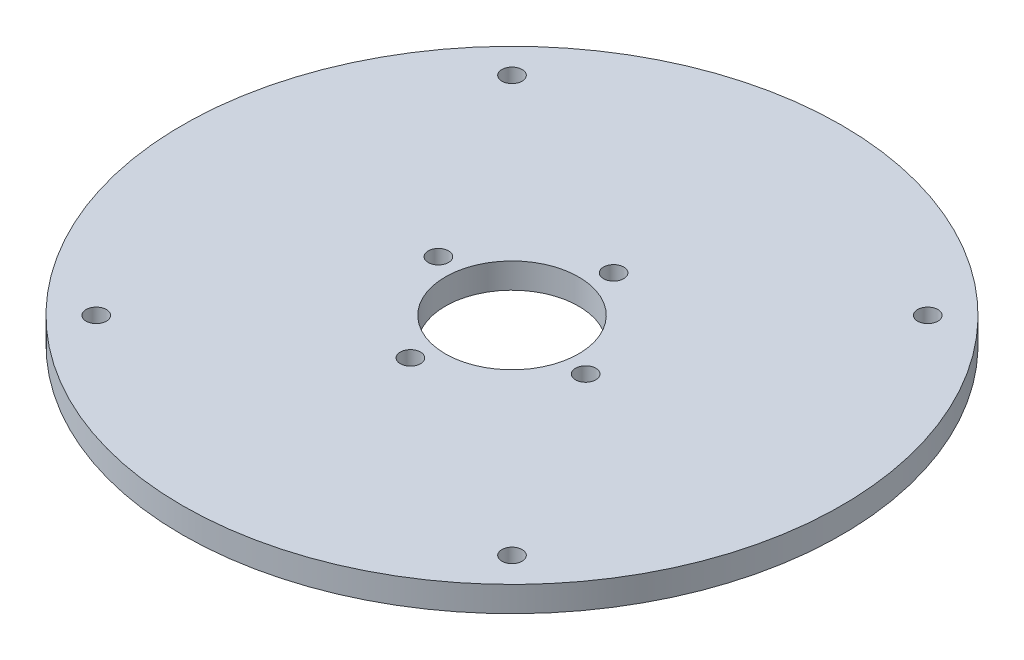
from build123d import *

# Parameters (mm, degrees)
SKETCH1_R           = 65
BOSS_EXTRUDE1_DEPTH = 5
SKETCH2_R           = 13.15
SKETCH2_R_2         = 2
CUT_EXTRUDE1_DEPTH  = 93.059763198
SKETCH4_R           = 2
CUT_EXTRUDE2_DEPTH  = 93.059763198


with BuildPart() as part:
    # Sketch1 → Boss-Extrude1 (new body)
    with BuildSketch(Plane(origin=(0, 0, 0), x_dir=(1, 0, 0), z_dir=(0, 1, 0))):
        with Locations(Location((0, 0, 0), (0, 0, 270))):
            Circle(SKETCH1_R)
    extrude(amount=BOSS_EXTRUDE1_DEPTH)

    # Sketch2 → Cut-Extrude1 (cut, through all)
    with BuildSketch(Plane(origin=(0, 5, 0), x_dir=(1, 0, 0), z_dir=(0, 1, 0))):
        with Locations(Location((0, 0, 0), (0, 0, 270))):
            Circle(SKETCH2_R)
        with Locations(Location((-17.281297977, 2.75803195, 0), (0, 0, 270))):
            Circle(SKETCH2_R_2)
        with Locations(Location((2.75803195, 17.281297977, 0), (0, 0, 270))):
            Circle(SKETCH2_R_2)
        with Locations(Location((17.281297977, -2.75803195, 0), (0, 0, 270))):
            Circle(SKETCH2_R_2)
        with Locations(Location((-2.75803195, -17.281297977, 0), (0, 0, 270))):
            Circle(SKETCH2_R_2)
    extrude(amount=-CUT_EXTRUDE1_DEPTH, mode=Mode.SUBTRACT)

    # Sketch4 → Cut-Extrude2 (cut, through all)
    with BuildSketch(Plane(origin=(0, 5, 0), x_dir=(1, 0, 0), z_dir=(0, 1, 0))):
        with Locations(Location((41, 41, 0), (0, 0, 270))):
            Circle(SKETCH4_R)
        with Locations(Location((41, -41, 0), (0, 0, 270))):
            Circle(SKETCH4_R)
        with Locations(Location((-41, -41, 0), (0, 0, 270))):
            Circle(SKETCH4_R)
        with Locations(Location((-41, 41, 0), (0, 0, 270))):
            Circle(SKETCH4_R)
    extrude(amount=-CUT_EXTRUDE2_DEPTH, mode=Mode.SUBTRACT)


solid = part.part
